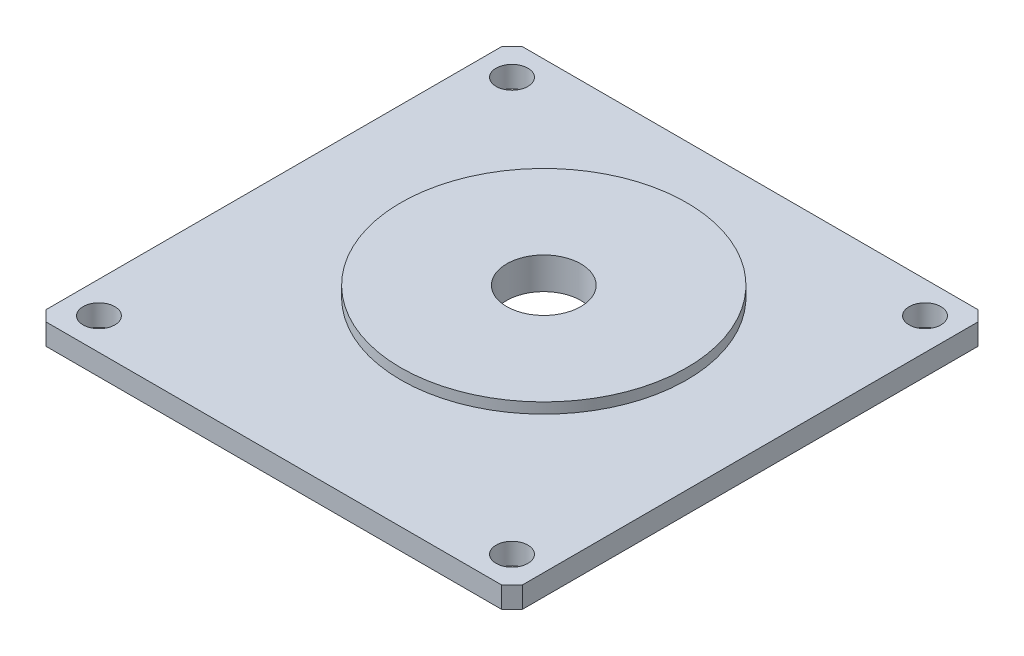
from build123d import *

# Parameters (mm, degrees)
SKETCH_1_W          = 45
SKETCH_1_H          = 45
EXTRUDE_1_DEPTH     = 2
SKETCH_2_R          = 3.5
CUT_EXTRUDE_1_DEPTH = 32.882597134
EXTRUDE_START       = 1
SKETCH_3_R          = 13.5
SKETCH_3_R_2        = 3.5
EXTRUDE_2_DEPTH     = 1
SKETCH_4_R          = 1.5
CUT_EXTRUDE_4_DEPTH = 32.960913629
CHAMFER_1_SIZE      = 1


with BuildPart() as part:
    # 草图1 → 凸台-拉伸1 (new body)
    with BuildSketch(Plane(origin=(0, 0, 0), x_dir=(1, 0, 0), z_dir=(0, 1, 0))):
        Rectangle(SKETCH_1_W, SKETCH_1_H)
    extrude(amount=EXTRUDE_1_DEPTH)

    # 草图2 → 切除-拉伸1 (cut, through all)
    with BuildSketch(Plane(origin=(0, 2, 0), x_dir=(1, 0, 0), z_dir=(0, 1, 0))):
        with Locations(Location((0, 3, 0), (0, 0, 270))):
            Circle(SKETCH_2_R)
    extrude(amount=-CUT_EXTRUDE_1_DEPTH, mode=Mode.SUBTRACT)

    # 草图3 → 凸台-拉伸2 (add)
    with BuildSketch(Plane(origin=(0, 2, 0), x_dir=(1, 0, 0), z_dir=(0, 1, 0)).offset(EXTRUDE_START)):
        with Locations(Location((0, 3, 0), (0, 0, 270))):
            Circle(SKETCH_3_R)
        with Locations(Location((0, 3, 0), (0, 0, 270))):
            Circle(SKETCH_3_R_2, mode=Mode.SUBTRACT)
    extrude(amount=-EXTRUDE_2_DEPTH)

    # 草图4 → 切除-拉伸4 (cut, through all)
    with BuildSketch(Plane(origin=(0, 0, 0), x_dir=(1, 0, 0), z_dir=(0, 1, 0))):
        with Locations(Location((19.5, 19.5, 0), (0, 0, 90))):
            Circle(SKETCH_4_R)
        with Locations(Location((-19.5, 19.5, 0), (0, 0, 90))):
            Circle(SKETCH_4_R)
        with Locations(Location((-19.5, -19.5, 0), (0, 0, 90))):
            Circle(SKETCH_4_R)
        with Locations(Location((19.5, -19.5, 0), (0, 0, 90))):
            Circle(SKETCH_4_R)
    extrude(amount=CUT_EXTRUDE_4_DEPTH, mode=Mode.SUBTRACT)

    # 倒角1
    chamfer_1_edges = [part.edges().sort_by_distance(p)[0] for p in [
        (22.5, 1, 22.5),
        (-22.5, 1, 22.5),
        (-22.5, 1, -22.5),
        (22.5, 1, -22.5),
    ]]
    chamfer(chamfer_1_edges, length=CHAMFER_1_SIZE)


solid = part.part
